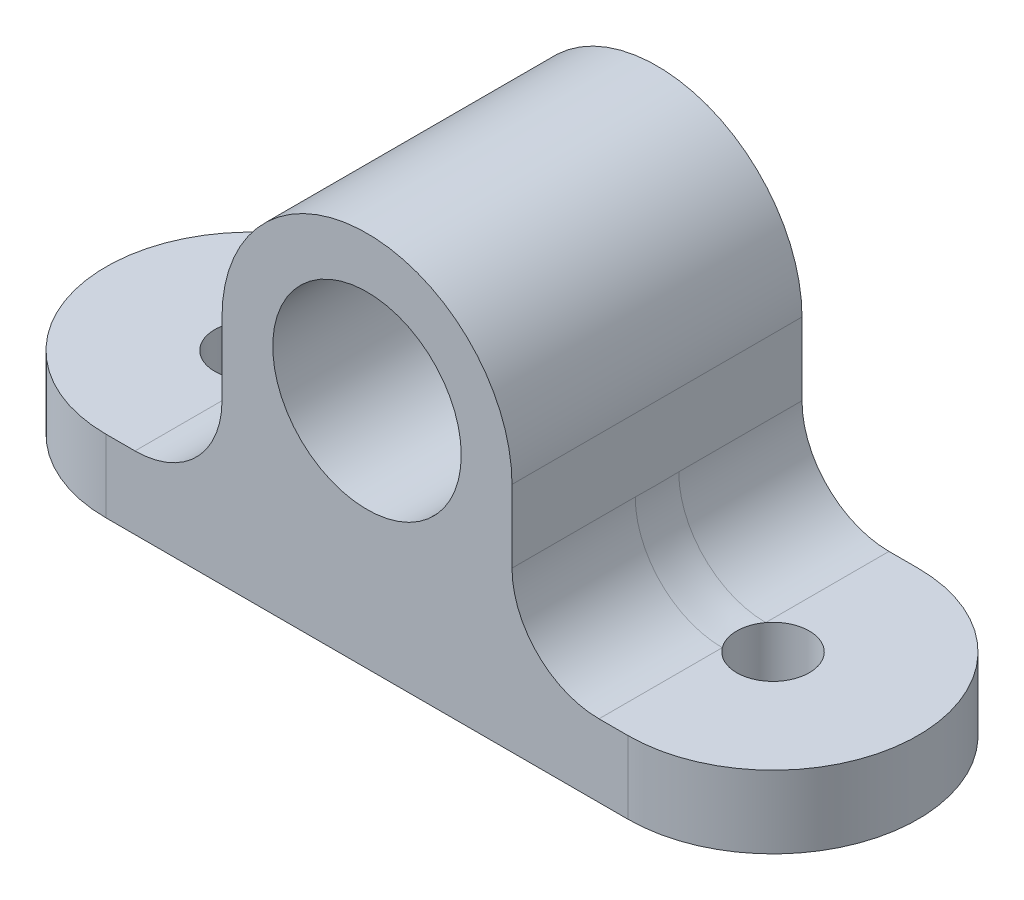
from build123d import *

# Parameters (mm, degrees)
ESTRUSIONE_ESTRUSIONE1_DEPTH = 5
SCHIZZO2_W                   = 20
SCHIZZO2_H                   = 20
ESTRUSIONE_ESTRUSIONE2_DEPTH = 21
RACCORDO1_RADIUS             = 10
RACCORDO1_LENGTH             = 20
SCHIZZO5_R                   = 6.5
TAGLIO_ESTRUSIONE4_DEPTH     = 57.497787567
SCHIZZO6_R                   = 2.5
TAGLIO_ESTRUSIONE5_DEPTH     = 55.378304497
RACCORDO2_R                  = 6


with BuildPart() as part:
    # Schizzo1 → Estrusione-Estrusione1 (new body)
    with BuildSketch(Plane(origin=(0, 0, 0), x_dir=(1, 0, 0), z_dir=(0, 1, 0))):
        with BuildLine():
            Line((0, 0), (36, 0))
            ThreePointArc((36, 0), (46, -10), (36, -20))
            Line((36, -20), (0, -20))
            ThreePointArc((0, -20), (-10, -10), (0, 0))
        make_face()
    extrude(amount=ESTRUSIONE_ESTRUSIONE1_DEPTH)

    # Schizzo2 → Estrusione-Estrusione2 (add)
    with BuildSketch(Plane(origin=(0, 5, 0), x_dir=(1, 0, 0), z_dir=(0, 1, 0))):
        with Locations((18, -10)):
            Rectangle(SCHIZZO2_W, SCHIZZO2_H)
    extrude(amount=ESTRUSIONE_ESTRUSIONE2_DEPTH)

    # Raccordo1: full round fillet: the end face becomes a half cylinder, R = half its width
    raccordo1_face = Plane((18, 26, 10), x_dir=(0, 0, 1), z_dir=(0, 1, 0))  # on the end face: x along it, z out of the body
    raccordo1_slab = raccordo1_face.offset(-RACCORDO1_RADIUS / 2) * Box(RACCORDO1_LENGTH, 2 * RACCORDO1_RADIUS, RACCORDO1_RADIUS, mode=Mode.PRIVATE)  # the body's end, R deep
    raccordo1_round = Plane((18, 16, 10), x_dir=(0, 1, 0), z_dir=(0, 0, 1)) * Cylinder(RACCORDO1_RADIUS, RACCORDO1_LENGTH, mode=Mode.PRIVATE)  # its axis R under the face
    add(raccordo1_slab - raccordo1_round, mode=Mode.SUBTRACT)

    # Schizzo5 → Taglio-Estrusione4 (cut, through all)
    with BuildSketch(Plane.XY.offset(20)):
        with Locations((18, 16)):
            Circle(SCHIZZO5_R)
    extrude(amount=-TAGLIO_ESTRUSIONE4_DEPTH, mode=Mode.SUBTRACT)

    # Schizzo6 → Taglio-Estrusione5 (cut, through all)
    with BuildSketch(Plane(origin=(0, 5, 0), x_dir=(1, 0, 0), z_dir=(0, 1, 0))):
        with Locations(Location((0, -10, 0), (0, 0, 270))):
            Circle(SCHIZZO6_R)
        with Locations(Location((36, -10, 0), (0, 0, 270))):
            Circle(SCHIZZO6_R)
    extrude(amount=-TAGLIO_ESTRUSIONE5_DEPTH, mode=Mode.SUBTRACT)

    # Raccordo2
    raccordo2_edges = [part.edges().sort_by_distance(p)[0] for p in [
        (8, 5, 10),
        (28, 5, 10),
    ]]
    fillet(raccordo2_edges, radius=RACCORDO2_R)


solid = part.part
